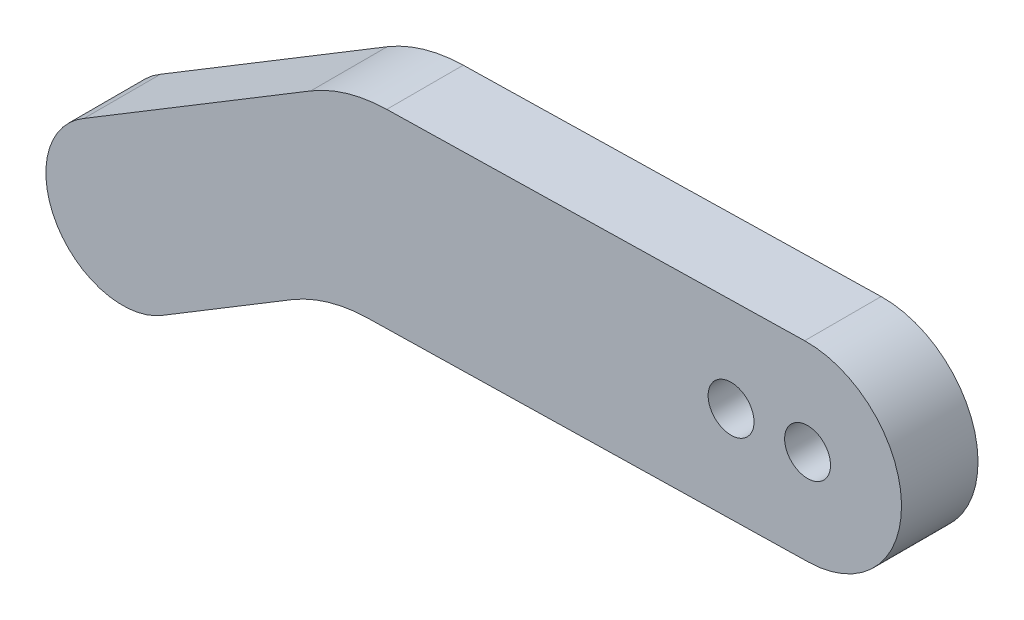
from build123d import *

# Parameters (mm, degrees)
BOSS_EXTRUDE1_DEPTH = 5
SKETCH4_R           = 1.5
CUT_EXTRUDE1_DEPTH  = 7


with BuildPart() as part:
    # Sketch3 → Boss-Extrude1 (new body)
    with BuildSketch(Plane.XY):
        with BuildLine():
            Line((0, 0), (14.819147534, 8.966206911))
            ThreePointArc((14.819147534, 8.966206911), (17.209951364, 10.014487306), (19.790605461, 10.408262847))
            Line((19.790605461, 10.408262847), (47.105361897, 10.968836088))
            ThreePointArc((47.105361897, 10.968836088), (53.436501891, 4.892334708), (47.360000511, -1.438805286))
            Line((47.360000511, -1.438805286), (18.550368321, -2.030057451))
            ThreePointArc((18.550368321, -2.030057451), (15.969714225, -2.423832993), (13.578910394, -3.472113387))
            Line((13.578910394, -3.472113387), (5.176641974, -8.555838818))
            ThreePointArc((5.176641974, -8.555838818), (-1.767072681, -6.913115578), (0, 0))
        make_face()
    extrude(amount=BOSS_EXTRUDE1_DEPTH)

    # Sketch4 → Cut-Extrude1 (cut)
    with BuildSketch(Plane.XY.offset(5)):
        with Locations((47.296340858, 4.765668567)):
            Circle(SKETCH4_R)
        with Locations((42.296340858, 4.714367155)):
            Circle(SKETCH4_R)
    extrude(amount=-CUT_EXTRUDE1_DEPTH, mode=Mode.SUBTRACT)


solid = part.part
